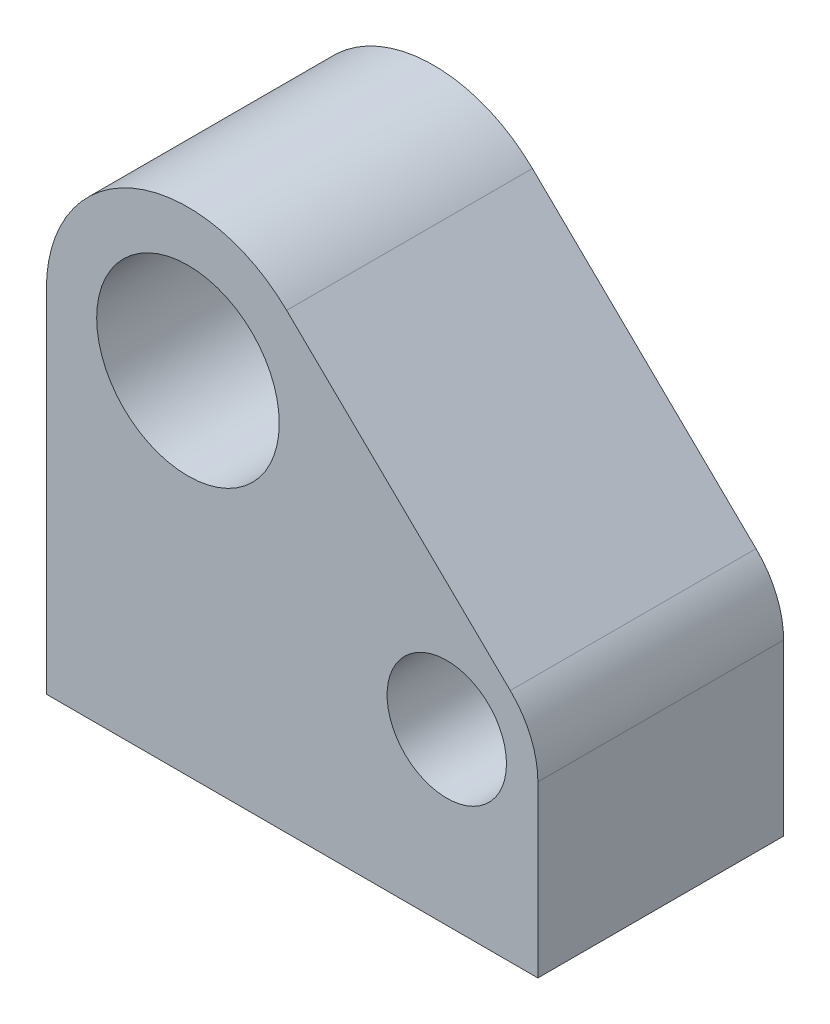
from build123d import *

# Parameters (mm, degrees)
CROQUIS1_R              = 2.6
CROQUIS1_R_2            = 1.7
SALIENTE_EXTRUIR1_DEPTH = 7


with BuildPart() as part:
    # Croquis1 → Saliente-Extruir1 (new body)
    with BuildSketch(Plane.XY):
        with BuildLine():
            Line((2.811164445, 2.891458498), (9.18120322, -3.301688153))
            ThreePointArc((9.18120322, -3.301688153), (9.762664554, -4.15232303), (9.967236954, -5.162187927))
            Line((9.967236954, -5.162187927), (9.967236954, -10))
            Line((9.967236954, -10), (-4.032763046, -10))
            Line((-4.032763046, -10), (-4.032763046, 0))
            ThreePointArc((-4.032763046, 0), (-1.569461324, 3.714830944), (2.811164445, 2.891458498))
        make_face()
        Circle(CROQUIS1_R, mode=Mode.SUBTRACT)
        with Locations((7.372368399, -5.162187927)):
            Circle(CROQUIS1_R_2, mode=Mode.SUBTRACT)
    extrude(amount=SALIENTE_EXTRUIR1_DEPTH)


solid = part.part
